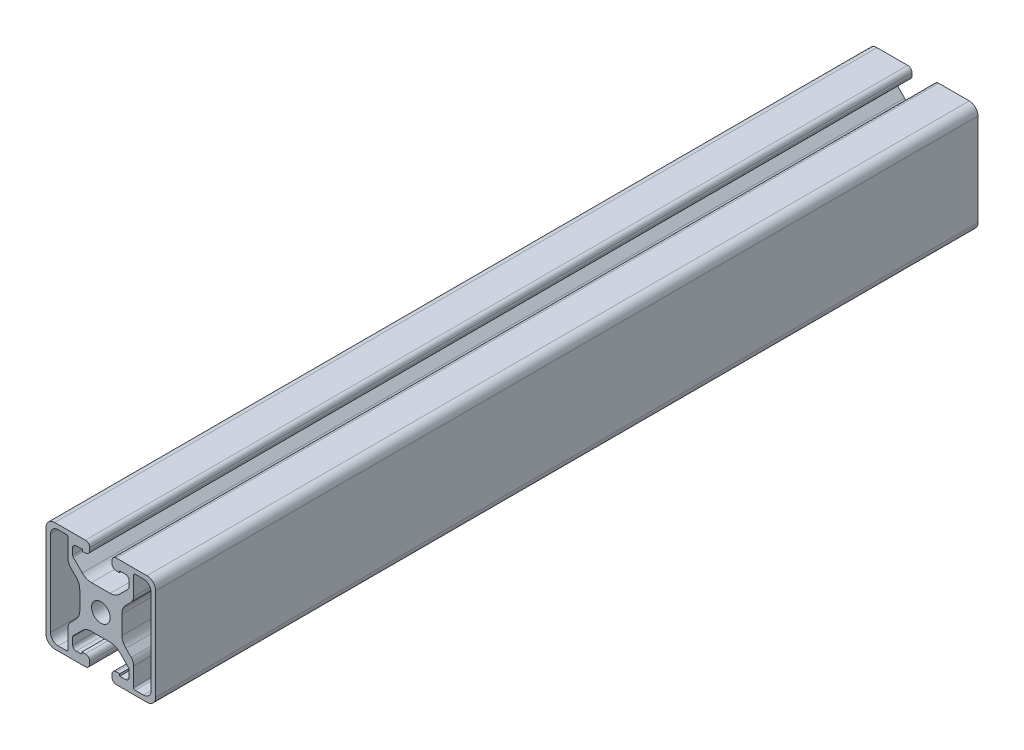
from build123d import *

# Parameters (mm, degrees)
SKETCH1_R      = 3.4
EXTRUDE1_DEPTH = 300


with BuildPart() as part:
    # Sketch1 → Extrude1 (new body)
    with BuildSketch(Plane.XY):
        with BuildLine():
            Line((3.414141554, 7.7), (-3.414141554, 7.7))
            ThreePointArc((-3.414141554, 7.7), (-5.219014233, 8.062418522), (-6.750527179, 9.083878589))
            Line((-6.750527179, 9.083878589), (-10.040658191, 12.367344817))
            ThreePointArc((-10.040658191, 12.367344817), (-10.221657959, 12.649942114), (-10.285, 12.979502327))
            Line((-10.285, 12.979502327), (-10.285, 15.292928509))
            ThreePointArc((-10.285, 15.292928509), (-9.913025612, 16.190954121), (-9.015, 16.562928509))
            Line((-9.015, 16.562928509), (-6.771827505, 16.562928509))
            Line((-6.771827505, 16.562928509), (-6.771827505, 15.94))
            Line((-6.771827505, 15.94), (-5.6348, 15.94))
            ThreePointArc((-5.6348, 15.94), (-4.521248241, 16.401248241), (-4.06, 17.5148))
            Line((-4.06, 17.5148), (-4.06, 18.4252))
            ThreePointArc((-4.06, 18.4252), (-4.521248241, 19.538751759), (-5.6348, 20))
            Line((-5.6348, 20), (-13.0175, 20))
            Line((-13.0175, 20), (-16.825, 20))
            ThreePointArc((-16.825, 20), (-19.07006403, 19.07006403), (-20, 16.825))
            Line((-20, 16.825), (-20, -16.825))
            ThreePointArc((-20, -16.825), (-19.07006403, -19.07006403), (-16.825, -20))
            Line((-16.825, -20), (-13.0175, -20))
            Line((-13.0175, -20), (-5.6348, -20))
            ThreePointArc((-5.6348, -20), (-4.521248241, -19.538751759), (-4.06, -18.4252))
            Line((-4.06, -18.4252), (-4.06, -17.5148))
            ThreePointArc((-4.06, -17.5148), (-4.521248241, -16.401248241), (-5.6348, -15.94))
            Line((-5.6348, -15.94), (-6.893826419, -15.94))
            Line((-6.893826419, -15.94), (-6.893826419, -16.702464473))
            Line((-6.893826419, -16.702464473), (-9.015, -16.702464473))
            ThreePointArc((-9.015, -16.702464473), (-9.913025612, -16.330490085), (-10.285, -15.432464473))
            Line((-10.285, -15.432464473), (-10.285, -12.948084155))
            ThreePointArc((-10.285, -12.948084155), (-10.217156337, -12.607462266), (-10.023980268, -12.318829212))
            Line((-10.023980268, -12.318829212), (-6.773258234, -9.074692133))
            ThreePointArc((-6.773258234, -9.074692133), (-5.238079583, -8.057096539), (-3.431215906, -7.7))
            Line((-3.431215906, -7.7), (3.431215906, -7.7))
            ThreePointArc((3.431215906, -7.7), (5.238079583, -8.057096539), (6.773258234, -9.074692133))
            Line((6.773258234, -9.074692133), (10.023980268, -12.318829212))
            ThreePointArc((10.023980268, -12.318829212), (10.217156337, -12.607462266), (10.285, -12.948084155))
            Line((10.285, -12.948084155), (10.285, -15.432464473))
            ThreePointArc((10.285, -15.432464473), (9.913025612, -16.330490085), (9.015, -16.702464473))
            Line((9.015, -16.702464473), (6.893826419, -16.702464473))
            Line((6.893826419, -16.702464473), (6.893826419, -15.94))
            Line((6.893826419, -15.94), (5.6348, -15.94))
            ThreePointArc((5.6348, -15.94), (4.521248241, -16.401248241), (4.06, -17.5148))
            Line((4.06, -17.5148), (4.06, -18.4252))
            ThreePointArc((4.06, -18.4252), (4.521248241, -19.538751759), (5.6348, -20))
            Line((5.6348, -20), (13.0175, -20))
            Line((13.0175, -20), (16.825, -20))
            ThreePointArc((16.825, -20), (19.07006403, -19.07006403), (20, -16.825))
            Line((20, -16.825), (20, 16.825))
            ThreePointArc((20, 16.825), (19.07006403, 19.07006403), (16.825, 20))
            Line((16.825, 20), (13.0175, 20))
            Line((13.0175, 20), (5.6348, 20))
            ThreePointArc((5.6348, 20), (4.521248241, 19.538751759), (4.06, 18.4252))
            Line((4.06, 18.4252), (4.06, 17.5148))
            ThreePointArc((4.06, 17.5148), (4.521248241, 16.401248241), (5.6348, 15.94))
            Line((5.6348, 15.94), (6.771827505, 15.94))
            Line((6.771827505, 15.94), (6.771827505, 16.562928509))
            Line((6.771827505, 16.562928509), (9.015, 16.562928509))
            ThreePointArc((9.015, 16.562928509), (9.913025612, 16.190954121), (10.285, 15.292928509))
            Line((10.285, 15.292928509), (10.285, 12.979502327))
            ThreePointArc((10.285, 12.979502327), (10.221657959, 12.649942114), (10.040658191, 12.367344817))
            Line((10.040658191, 12.367344817), (6.750527179, 9.083878589))
            ThreePointArc((6.750527179, 9.083878589), (5.219014233, 8.062418522), (3.414141554, 7.7))
        make_face()
        Circle(SKETCH1_R, mode=Mode.SUBTRACT)
        with BuildLine():
            Line((-12.564539323, -18.35), (-15.5575, -18.35))
            ThreePointArc((-15.5575, -18.35), (-17.531656749, -17.531656749), (-18.35, -15.5575))
            Line((-18.35, -15.5575), (-18.35, 15.5575))
            ThreePointArc((-18.35, 15.5575), (-17.531656749, 17.531656749), (-15.5575, 18.35))
            Line((-15.5575, 18.35), (-12.566039323, 18.35))
            ThreePointArc((-12.566039323, 18.35), (-12.121960893, 18.165032537), (-11.935, 17.721789669))
            Line((-11.935, 17.721789669), (-11.935, 10.955500711))
            ThreePointArc((-11.935, 10.955500711), (-11.692410278, 9.694593073), (-10.97025746, 8.632880704))
            Line((-10.97025746, 8.632880704), (-9.032953263, 6.699500885))
            ThreePointArc((-9.032953263, 6.699500885), (-8.018239143, 5.133591891), (-7.685, 3.297654148))
            Line((-7.685, 3.297654148), (-7.685, -3.50798046))
            ThreePointArc((-7.685, -3.50798046), (-8.092979352, -5.282450357), (-9.138589048, -6.773051218))
            Line((-9.138589048, -6.773051218), (-11.073928072, -8.704469846))
            ThreePointArc((-11.073928072, -8.704469846), (-11.72635669, -9.745106152), (-11.935, -10.955500711))
            Line((-11.935, -10.955500711), (-11.935, -17.721789669))
            ThreePointArc((-11.935, -17.721789669), (-12.121425838, -18.164510172), (-12.564539323, -18.35))
        make_face(mode=Mode.SUBTRACT)
        with BuildLine():
            Line((11.935, -10.955500711), (11.935, -17.721789669))
            ThreePointArc((11.935, -17.721789669), (12.121425838, -18.164510172), (12.564539323, -18.35))
            Line((12.564539323, -18.35), (15.5575, -18.35))
            ThreePointArc((15.5575, -18.35), (17.531656749, -17.531656749), (18.35, -15.5575))
            Line((18.35, -15.5575), (18.35, 15.5575))
            ThreePointArc((18.35, 15.5575), (17.531656749, 17.531656749), (15.5575, 18.35))
            Line((15.5575, 18.35), (12.566039323, 18.35))
            ThreePointArc((12.566039323, 18.35), (12.121960893, 18.165032537), (11.935, 17.721789669))
            Line((11.935, 17.721789669), (11.935, 10.955500711))
            ThreePointArc((11.935, 10.955500711), (11.692410278, 9.694593073), (10.97025746, 8.632880704))
            Line((10.97025746, 8.632880704), (9.032953263, 6.699500885))
            ThreePointArc((9.032953263, 6.699500885), (8.018239143, 5.133591891), (7.685, 3.297654148))
            Line((7.685, 3.297654148), (7.685, -3.50798046))
            ThreePointArc((7.685, -3.50798046), (8.092979352, -5.282450357), (9.138589048, -6.773051218))
            Line((9.138589048, -6.773051218), (11.073928072, -8.704469846))
            ThreePointArc((11.073928072, -8.704469846), (11.72635669, -9.745106152), (11.935, -10.955500711))
        make_face(mode=Mode.SUBTRACT)
    extrude(amount=-EXTRUDE1_DEPTH)


solid = part.part
